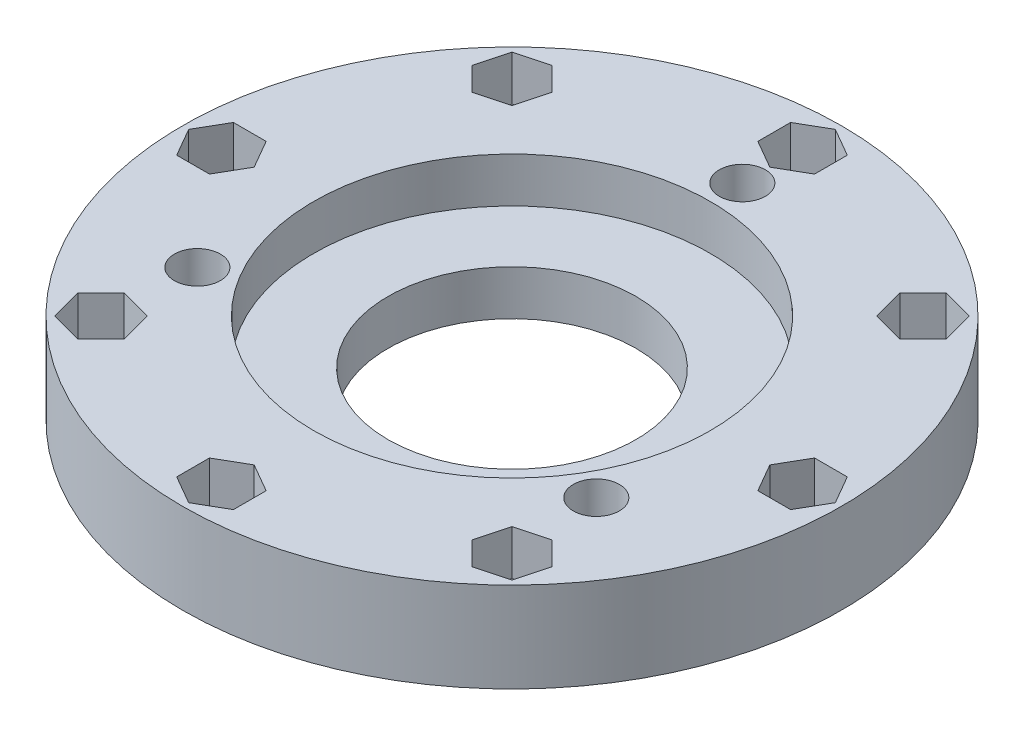
from build123d import *

# Parameters (mm, degrees)
SKETCH1_R           = 46.5
SKETCH1_R_2         = 2.5
SKETCH1_R_3         = 17.5
BOSS_EXTRUDE1_DEPTH = 12.7
SKETCH2_R           = 28
CUT_EXTRUDE1_DEPTH  = 6.35
SKETCH3_R           = 2.5
CUT_EXTRUDE2_DEPTH  = 6.35
SKETCH4_R           = 3.25
CUT_EXTRUDE3_DEPTH  = 6.35


with BuildPart() as part:
    # Sketch1 → Boss-Extrude1 (new body)
    with BuildSketch(Plane(origin=(0, 0, 0), x_dir=(1, 0, 0), z_dir=(0, 1, 0))):
        with Locations(Location((0, 0, 0), (0, 0, 270))):
            Circle(SKETCH1_R)
        with Locations(Location((0, 32.5, 0), (0, 0, 270))):
            Circle(SKETCH1_R_2, mode=Mode.SUBTRACT)
        with Locations(Location((28.145825623, -16.25, 0), (0, 0, 270))):
            Circle(SKETCH1_R_2, mode=Mode.SUBTRACT)
        with Locations(Location((-28.145825623, -16.25, 0), (0, 0, 270))):
            Circle(SKETCH1_R_2, mode=Mode.SUBTRACT)
        with Locations(Location((0, 0, 0), (0, 0, 270))):
            Circle(SKETCH1_R_3, mode=Mode.SUBTRACT)
    extrude(amount=BOSS_EXTRUDE1_DEPTH)

    # Sketch2 → Cut-Extrude1 (cut)
    with BuildSketch(Plane(origin=(0, 12.7, 0), x_dir=(1, 0, 0), z_dir=(0, 1, 0))):
        with Locations(Location((0, 0, 0), (0, 0, 270))):
            Circle(SKETCH2_R)
    extrude(amount=-CUT_EXTRUDE1_DEPTH, mode=Mode.SUBTRACT)

    # Sketch3 → Cut-Extrude2 (cut)
    with BuildSketch(Plane(origin=(0, 12.7, 0), x_dir=(1, 0, 0), z_dir=(0, 1, 0))):
        with Locations(Location((0, 41, 0), (0, 0, 270))):
            Circle(SKETCH3_R)
        with Locations(Location((28.991378029, 28.991378029, 0), (0, 0, 270))):
            Circle(SKETCH3_R)
        with Locations(Location((41, 0, 0), (0, 0, 270))):
            Circle(SKETCH3_R)
        with Locations(Location((28.991378029, -28.991378029, 0), (0, 0, 270))):
            Circle(SKETCH3_R)
        with Locations(Location((0, -41, 0), (0, 0, 270))):
            Circle(SKETCH3_R)
        with Locations(Location((-28.991378029, -28.991378029, 0), (0, 0, 270))):
            Circle(SKETCH3_R)
        with Locations(Location((-41, 0, 0), (0, 0, 270))):
            Circle(SKETCH3_R)
        with Locations(Location((-28.991378029, 28.991378029, 0), (0, 0, 270))):
            Circle(SKETCH3_R)
    extrude(amount=-CUT_EXTRUDE2_DEPTH, mode=Mode.SUBTRACT)

    # Sketch4 → Cut-Extrude3 (cut)
    with BuildSketch(Plane(origin=(0, 12.7, 0), x_dir=(1, 0, 0), z_dir=(0, 1, 0))):
        with Locations(Location((0, 32.5, 0), (0, 0, 270))):
            Circle(SKETCH4_R)
        with Locations(Location((28.145825623, -16.25, 0), (0, 0, 270))):
            Circle(SKETCH4_R)
        with Locations(Location((-28.145825623, -16.25, 0), (0, 0, 270))):
            Circle(SKETCH4_R)
        Polygon((0, 45.618802154), (-4, 43.309401077), (-4, 38.690598923), (0, 36.381197846), (4, 38.690598923), (4, 43.309401077), align=None)
        Polygon((33.452798315, 27.795944066), (32.257364352, 32.257364352), (27.795944066, 33.452798315), (24.529957742, 30.186811992), (25.725391705, 25.725391705), (30.186811992, 24.529957742), align=None)
        Polygon((43.309401077, -4), (45.618802154, 0), (43.309401077, 4), (38.690598923, 4), (36.381197846, 0), (38.690598923, -4), align=None)
        Polygon((27.795944066, -33.452798315), (32.257364352, -32.257364352), (33.452798315, -27.795944066), (30.186811992, -24.529957742), (25.725391705, -25.725391705), (24.529957742, -30.186811992), align=None)
        Polygon((-4, -43.309401077), (0, -45.618802154), (4, -43.309401077), (4, -38.690598923), (0, -36.381197846), (-4, -38.690598923), align=None)
        Polygon((-33.452798315, -27.795944066), (-32.257364352, -32.257364352), (-27.795944066, -33.452798315), (-24.529957742, -30.186811992), (-25.725391705, -25.725391705), (-30.186811992, -24.529957742), align=None)
        Polygon((-43.309401077, 4), (-45.618802154, 0), (-43.309401077, -4), (-38.690598923, -4), (-36.381197846, 0), (-38.690598923, 4), align=None)
        Polygon((-27.795944066, 33.452798315), (-32.257364352, 32.257364352), (-33.452798315, 27.795944066), (-30.186811992, 24.529957742), (-25.725391705, 25.725391705), (-24.529957742, 30.186811992), align=None)
    extrude(amount=-CUT_EXTRUDE3_DEPTH, mode=Mode.SUBTRACT)


solid = part.part
